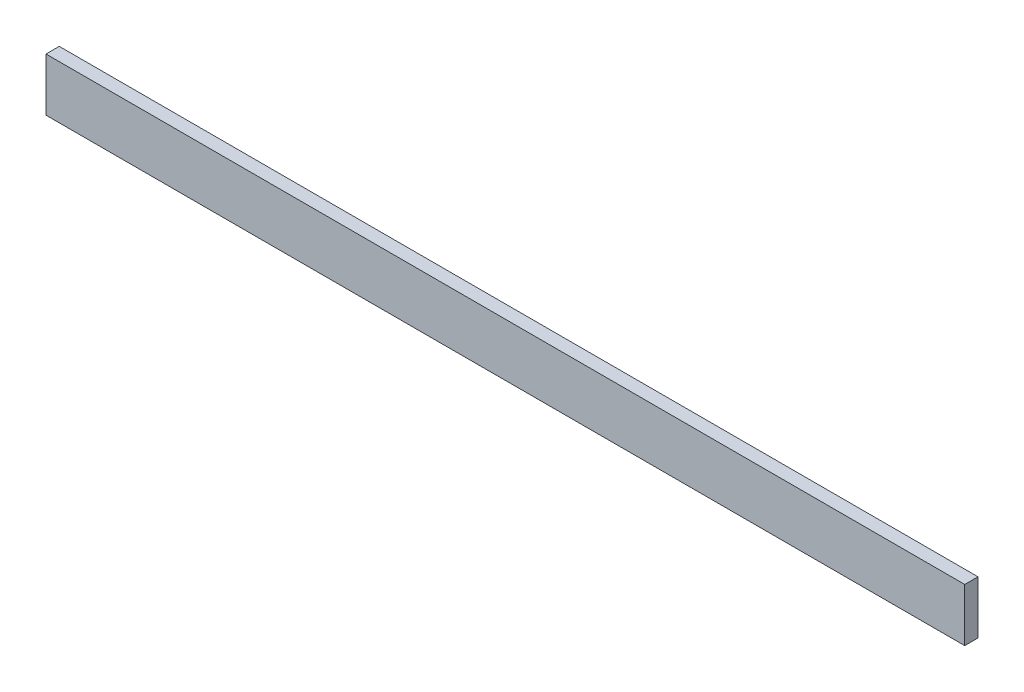
from build123d import *

# Parameters (mm, degrees)
CROQUIS1_W              = 208
CROQUIS1_H              = 12
SALIENTE_EXTRUIR1_DEPTH = 3


with BuildPart() as part:
    # Croquis1 → Saliente-Extruir1 (new body)
    with BuildSketch(Plane.XY):
        with Locations((44.232961929, -1.48891709)):
            Rectangle(CROQUIS1_W, CROQUIS1_H)
    extrude(amount=SALIENTE_EXTRUIR1_DEPTH)


solid = part.part
